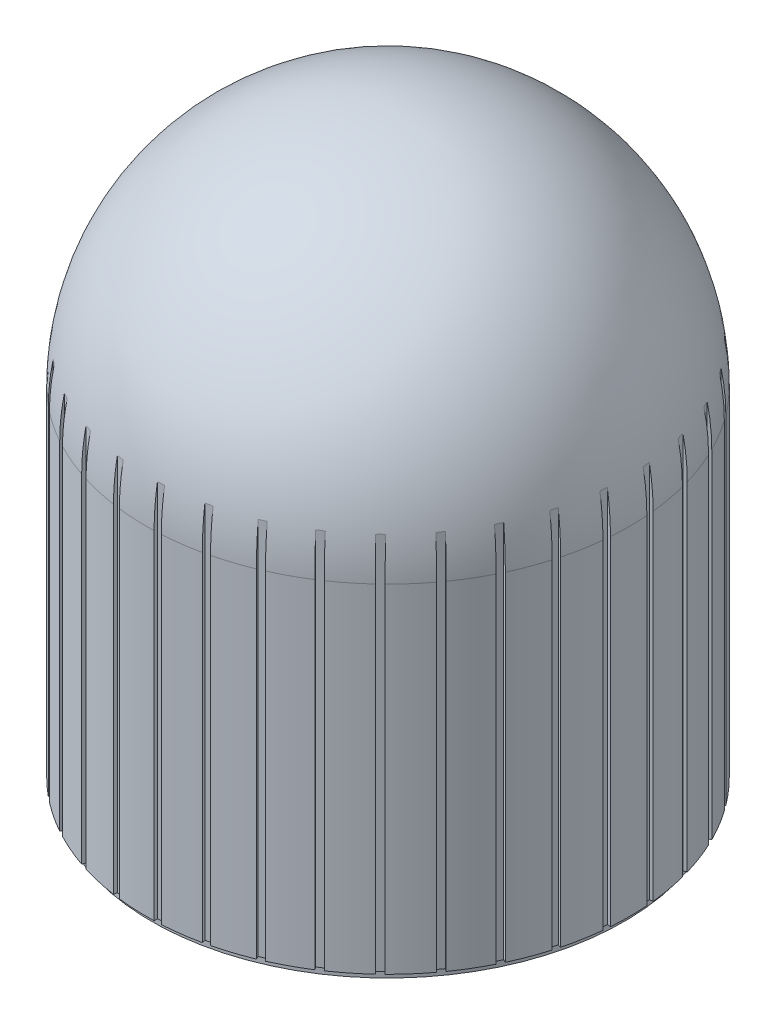
from build123d import *

# Parameters (mm, degrees)
SKETCH_1_R               = 7
EXTRUDE_1_DEPTH          = 10
SKETCH_2_R               = 3
CUT_EXTRUDE_1_DEPTH      = 4
REVOLVE_1_ANGLE          = 180
CUT_EXTRUDE_2_DEPTH      = 20.672315573
PATTERN_CIRCULAR_1_COUNT = 35
SKETCH_5_R               = 7.217628059
SKETCH_5_R_2             = 6.85
CUT_EXTRUDE_3_DEPTH      = 0.2


with BuildPart() as part:
    # 草图1 → 凸台-拉伸1 (new body)
    with BuildSketch(Plane(origin=(0, 0, 0), x_dir=(1, 0, 0), z_dir=(0, 1, 0))):
        Circle(SKETCH_1_R)
        with BuildLine():
            Line((-2.598076211, 1.5), (2.598076211, 1.5))
            ThreePointArc((2.598076211, 1.5), (0, -3), (-2.598076211, 1.5))
        make_face(mode=Mode.SUBTRACT)
    extrude(amount=EXTRUDE_1_DEPTH)

    # 草图2 → 切除-拉伸1 (cut)
    with BuildSketch(Plane.XZ):
        Circle(SKETCH_2_R)
    extrude(amount=-CUT_EXTRUDE_1_DEPTH, mode=Mode.SUBTRACT)

    # 草图3 → 旋转1 (revolve)
    with BuildSketch(Plane(origin=(0, 10, 0), x_dir=(1, 0, 0), z_dir=(0, 1, 0))):
        with BuildLine():
            Line((0, 7), (0, -7))
            ThreePointArc((0, -7), (-7, 0), (0, 7))
        make_face()
    revolve(axis=Axis((0, 10, -7), (0, 0, -1)), revolution_arc=REVOLVE_1_ANGLE)

    # 草图4 → 切除-拉伸2 (cut, through all)
    with BuildSketch(Plane.XZ):
        with BuildLine():
            Line((-6.899285678, -0.1), (-6.899285678, 0.1))
            Line((-6.899285678, 0.1), (-6.999285678, 0.1))
            ThreePointArc((-6.999285678, 0.1), (-7, 0), (-6.999285678, -0.1))
            Line((-6.999285678, -0.1), (-6.899285678, -0.1))
        make_face()
    cut_extrude_2 = extrude(amount=-CUT_EXTRUDE_2_DEPTH, mode=Mode.SUBTRACT)

    # 阵列(圆周)1: 切除-拉伸2 ×35 about axis
    pattern_circular_1_axis = Axis((0, 3.67544468, 0), (0, -1, 0))
    for i in range(1, PATTERN_CIRCULAR_1_COUNT):
        add(cut_extrude_2.rotate(pattern_circular_1_axis, i * 360 / PATTERN_CIRCULAR_1_COUNT), mode=Mode.SUBTRACT)

    # 草图5 → 切除-拉伸3 (cut)
    with BuildSketch(Plane.XZ):
        Circle(SKETCH_5_R)
        Circle(SKETCH_5_R_2, mode=Mode.SUBTRACT)
    extrude(amount=-CUT_EXTRUDE_3_DEPTH, mode=Mode.SUBTRACT)


solid = part.part
